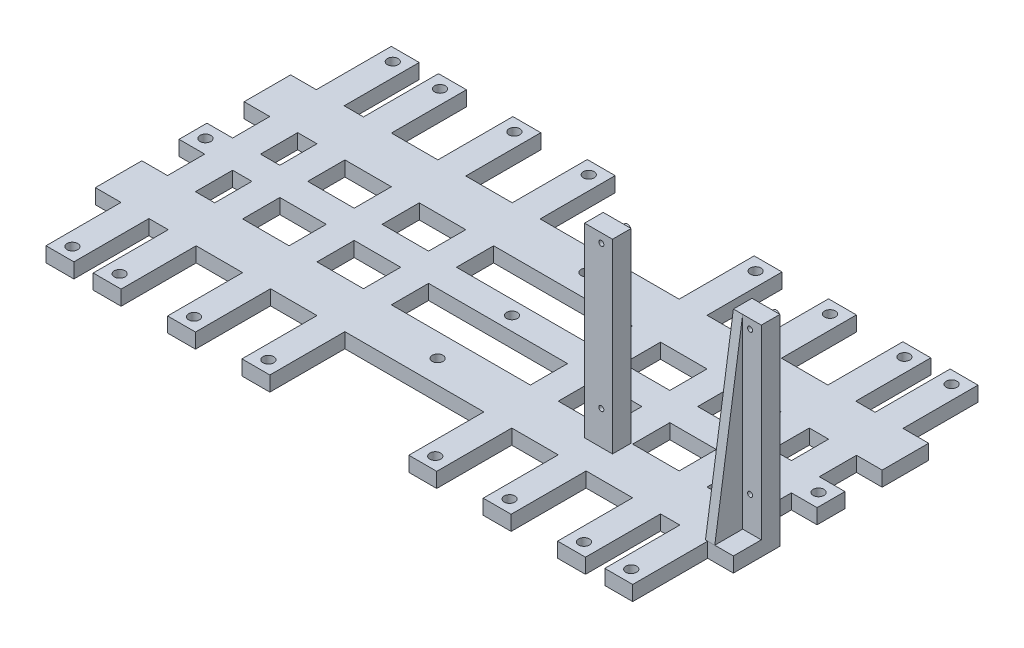
from build123d import *

# Parameters (mm, degrees)
SKETCH1_W           = 15
SKETCH1_H           = 185.68
SKETCH1_R           = 2.895
SKETCH1_W_2         = 343.08
SKETCH1_H_2         = 25
SKETCH1_H_3         = 15
BOSS_EXTRUDE1_DEPTH = 8
SKETCH2_W           = 15
SKETCH2_H           = 10
BOSS_EXTRUDE2_DEPTH = 100
SKETCH3_R           = 2
BOSS_EXTRUDE3_DEPTH = 4
CUT_EXTRUDE1_REACH  = 367.547
SKETCH5_R           = 1.35
BOSS_EXTRUDE4_DEPTH = 5


with BuildPart() as part:
    # Sketch1 → Boss-Extrude1 (new body)
    # profile 1 of 11: a face of its own
    with BuildSketch(Plane(origin=(0, 0, 0), x_dir=(1, 0, 0), z_dir=(0, 1, 0))):
        with Locations((-7.5, 92.84)):
            Rectangle(SKETCH1_W, SKETCH1_H)
        with Locations(Location((-7.5, 6.7, 0), (0, 0, 270))):
            Circle(SKETCH1_R, mode=Mode.SUBTRACT)
        with Locations(Location((-7.5, 178.98, 0), (0, 0, 270))):
            Circle(SKETCH1_R, mode=Mode.SUBTRACT)
    # profile 2 of 11: a face of its own
    with BuildSketch(Plane(origin=(0, 0, 0), x_dir=(1, 0, 0), z_dir=(0, 1, 0))):
        with Locations((-32.89, 92.84)):
            Rectangle(SKETCH1_W, SKETCH1_H)
        with Locations(Location((-32.89, 6.7, 0), (0, 0, 270))):
            Circle(SKETCH1_R, mode=Mode.SUBTRACT)
        with Locations(Location((-32.89, 178.98, 0), (0, 0, 270))):
            Circle(SKETCH1_R, mode=Mode.SUBTRACT)
    # profile 3 of 11: a face of its own
    with BuildSketch(Plane(origin=(0, 0, 0), x_dir=(1, 0, 0), z_dir=(0, 1, 0))):
        with Locations((-72.88, 92.84)):
            Rectangle(SKETCH1_W, SKETCH1_H)
        with Locations(Location((-72.88, 6.7, 0), (0, 0, 270))):
            Circle(SKETCH1_R, mode=Mode.SUBTRACT)
        with Locations(Location((-72.88, 178.98, 0), (0, 0, 270))):
            Circle(SKETCH1_R, mode=Mode.SUBTRACT)
    # profile 4 of 11: a face of its own
    with BuildSketch(Plane(origin=(0, 0, 0), x_dir=(1, 0, 0), z_dir=(0, 1, 0))):
        with Locations((-112.87, 92.84)):
            Rectangle(SKETCH1_W, SKETCH1_H)
        with Locations(Location((-112.87, 6.7, 0), (0, 0, 270))):
            Circle(SKETCH1_R, mode=Mode.SUBTRACT)
        with Locations(Location((-112.87, 178.98, 0), (0, 0, 270))):
            Circle(SKETCH1_R, mode=Mode.SUBTRACT)
    # profile 5 of 11: a face of its own
    with BuildSketch(Plane(origin=(0, 0, 0), x_dir=(1, 0, 0), z_dir=(0, 1, 0))):
        with Locations((-157.74, 52.84)):
            Rectangle(SKETCH1_W_2, SKETCH1_H_2)
        with Locations(Location((-157.74, 52.84, 0), (0, 0, 270))):
            Circle(SKETCH1_R, mode=Mode.SUBTRACT)
    # profile 6 of 11: a face of its own
    with BuildSketch(Plane(origin=(0, 0, 0), x_dir=(1, 0, 0), z_dir=(0, 1, 0))):
        with Locations((-157.74, 92.84)):
            Rectangle(SKETCH1_W_2, SKETCH1_H_3)
        with Locations(Location((7.1, 92.84, 0), (0, 0, 270))):
            Circle(SKETCH1_R, mode=Mode.SUBTRACT)
        with Locations(Location((-157.74, 92.84, 0), (0, 0, 270))):
            Circle(SKETCH1_R, mode=Mode.SUBTRACT)
        with Locations(Location((-322.58, 92.84, 0), (0, 0, 270))):
            Circle(SKETCH1_R, mode=Mode.SUBTRACT)
    # profile 7 of 11: a face of its own
    with BuildSketch(Plane(origin=(0, 0, 0), x_dir=(1, 0, 0), z_dir=(0, 1, 0))):
        with Locations((-157.74, 132.84)):
            Rectangle(SKETCH1_W_2, SKETCH1_H_2)
        with Locations(Location((-157.74, 132.84, 0), (0, 0, 270))):
            Circle(SKETCH1_R, mode=Mode.SUBTRACT)
    # profile 8 of 11: a face of its own
    with BuildSketch(Plane(origin=(0, 0, 0), x_dir=(1, 0, 0), z_dir=(0, 1, 0))):
        with Locations((-202.61, 92.84)):
            Rectangle(SKETCH1_W, SKETCH1_H)
        with Locations(Location((-202.61, 178.98, 0), (0, 0, 270))):
            Circle(SKETCH1_R, mode=Mode.SUBTRACT)
        with Locations(Location((-202.61, 6.7, 0), (0, 0, 270))):
            Circle(SKETCH1_R, mode=Mode.SUBTRACT)
    # profile 9 of 11: a face of its own
    with BuildSketch(Plane(origin=(0, 0, 0), x_dir=(1, 0, 0), z_dir=(0, 1, 0))):
        with Locations((-242.6, 92.84)):
            Rectangle(SKETCH1_W, SKETCH1_H)
        with Locations(Location((-242.6, 178.98, 0), (0, 0, 270))):
            Circle(SKETCH1_R, mode=Mode.SUBTRACT)
        with Locations(Location((-242.6, 6.7, 0), (0, 0, 270))):
            Circle(SKETCH1_R, mode=Mode.SUBTRACT)
    # profile 10 of 11: a face of its own
    with BuildSketch(Plane(origin=(0, 0, 0), x_dir=(1, 0, 0), z_dir=(0, 1, 0))):
        with Locations((-282.59, 92.84)):
            Rectangle(SKETCH1_W, SKETCH1_H)
        with Locations(Location((-282.59, 178.98, 0), (0, 0, 270))):
            Circle(SKETCH1_R, mode=Mode.SUBTRACT)
        with Locations(Location((-282.59, 6.7, 0), (0, 0, 270))):
            Circle(SKETCH1_R, mode=Mode.SUBTRACT)
    # profile 11 of 11: a face of its own
    with BuildSketch(Plane(origin=(0, 0, 0), x_dir=(1, 0, 0), z_dir=(0, 1, 0))):
        with Locations((-307.98, 92.84)):
            Rectangle(SKETCH1_W, SKETCH1_H)
        with Locations(Location((-307.98, 178.98, 0), (0, 0, 270))):
            Circle(SKETCH1_R, mode=Mode.SUBTRACT)
        with Locations(Location((-307.98, 6.7, 0), (0, 0, 270))):
            Circle(SKETCH1_R, mode=Mode.SUBTRACT)
    extrude(amount=BOSS_EXTRUDE1_DEPTH)

    # Sketch2 → Boss-Extrude2 (add)
    with BuildSketch(Plane(origin=(0, 8, 0), x_dir=(1, 0, 0), z_dir=(0, 1, 0))):
        with Locations((6.3, 60.34)):
            Rectangle(SKETCH2_W, SKETCH2_H)
        with Locations((-73.7, 60.34)):
            Rectangle(SKETCH2_W, SKETCH2_H)
    extrude(amount=BOSS_EXTRUDE2_DEPTH)

    # Sketch3 → Boss-Extrude3 (add)
    with BuildSketch(Plane(origin=(0, 0, -65.34), x_dir=(-1, 0, 0), z_dir=(0, 0, -1))):
        with Locations(Location((-7.8, 103.1, 0), (0, 0, 180))):
            Circle(SKETCH3_R)
        with Locations(Location((-7.8, 26.15, 0), (0, 0, 180))):
            Circle(SKETCH3_R)
        with Locations(Location((72.2, 26.15, 0), (0, 0, 180))):
            Circle(SKETCH3_R)
        with Locations(Location((72.2, 103.1, 0), (0, 0, 180))):
            Circle(SKETCH3_R)
    extrude(amount=BOSS_EXTRUDE3_DEPTH)

    # Sketch5 → Cut-Extrude1 (cut, up to next)
    with BuildSketch(Plane(origin=(0, 0, -69.34), x_dir=(-1, 0, 0), z_dir=(0, 0, -1)), mode=Mode.PRIVATE) as cut_extrude1_sk1:
        with Locations((-7.8, 103.1)):
            Circle(SKETCH5_R)
    cut_extrude1_tool1 = extrude(cut_extrude1_sk1.sketch, amount=-CUT_EXTRUDE1_REACH, mode=Mode.PRIVATE) & part.part
    # Sketch5 → Cut-Extrude1 (cut, up to next)
    with BuildSketch(Plane(origin=(0, 0, -69.34), x_dir=(-1, 0, 0), z_dir=(0, 0, -1)), mode=Mode.PRIVATE) as cut_extrude1_sk2:
        with Locations((-7.8, 26.15)):
            Circle(SKETCH5_R)
    cut_extrude1_tool2 = extrude(cut_extrude1_sk2.sketch, amount=-CUT_EXTRUDE1_REACH, mode=Mode.PRIVATE) & part.part
    # Sketch5 → Cut-Extrude1 (cut, up to next)
    with BuildSketch(Plane(origin=(0, 0, -69.34), x_dir=(-1, 0, 0), z_dir=(0, 0, -1)), mode=Mode.PRIVATE) as cut_extrude1_sk3:
        with Locations((72.2, 26.15)):
            Circle(SKETCH5_R)
    cut_extrude1_tool3 = extrude(cut_extrude1_sk3.sketch, amount=-CUT_EXTRUDE1_REACH, mode=Mode.PRIVATE) & part.part
    # Sketch5 → Cut-Extrude1 (cut, up to next)
    with BuildSketch(Plane(origin=(0, 0, -69.34), x_dir=(-1, 0, 0), z_dir=(0, 0, -1)), mode=Mode.PRIVATE) as cut_extrude1_sk4:
        with Locations((72.2, 103.1)):
            Circle(SKETCH5_R)
    cut_extrude1_tool4 = extrude(cut_extrude1_sk4.sketch, amount=-CUT_EXTRUDE1_REACH, mode=Mode.PRIVATE) & part.part
    add(cut_extrude1_tool1.solids().sort_by_distance((7.8, 103.1, -69.34))[0], mode=Mode.SUBTRACT)
    add(cut_extrude1_tool2.solids().sort_by_distance((7.8, 26.15, -69.34))[0], mode=Mode.SUBTRACT)
    add(cut_extrude1_tool3.solids().sort_by_distance((-72.2, 26.15, -69.34))[0], mode=Mode.SUBTRACT)
    add(cut_extrude1_tool4.solids().sort_by_distance((-72.2, 103.1, -69.34))[0], mode=Mode.SUBTRACT)

    # Sketch7 → Boss-Extrude4 (add)
    with BuildSketch(Plane.ZY.offset(1.2)):
        Polygon((-40.34, 8), (-55.34, 108), (-55.34, 8), align=None)
    extrude(amount=-BOSS_EXTRUDE4_DEPTH)


solid = part.part
